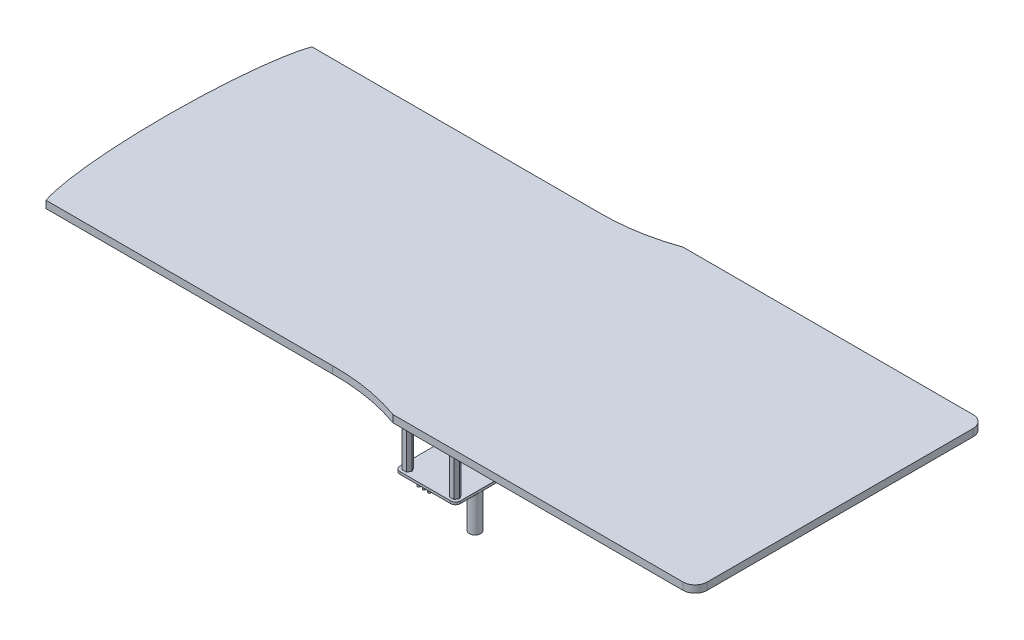
from build123d import *

# Parameters (mm, degrees)
SKETCH_1_W          = 280
SKETCH_1_H          = 120
EXTRUDE_1_DEPTH     = 3
CUT_EXTRUDE_1_DEPTH = 3
CUT_EXTRUDE_2_DEPTH = 3
CUT_EXTRUDE_3_DEPTH = 3
CUT_EXTRUDE_4_DEPTH = 153.345003333
EXTRUDE_2_DEPTH     = 25
SKETCH_6_W          = 25
SKETCH_6_H          = 61
EXTRUDE_3_DEPTH     = 1
SKETCH_7_W          = 8.681884025
SKETCH_7_H          = 50
EXTRUDE_4_DEPTH     = 1
SKETCH_8_W          = 8.681884025
SKETCH_8_H          = 4
SKETCH_8_H_2        = 1.5
CUT_EXTRUDE_5_DEPTH = 1
SKETCH_9_R          = 0.5
EXTRUDE_5_DEPTH     = 7
CUT_EXTRUDE_6_DEPTH = 7
SKETCH_11_W         = 5
SKETCH_11_H         = 4
EXTRUDE_6_DEPTH     = 8
CUT_EXTRUDE_7_DEPTH = 8
SKETCH_13_R         = 0.5
CUT_EXTRUDE_8_DEPTH = 2
SKETCH_14_W         = 1
SKETCH_14_H         = 2
CUT_EXTRUDE_9_DEPTH = 2
SKETCH_15_R         = 2.321585409
EXTRUDE_7_DEPTH     = 15


with BuildPart() as part:
    # 스케치1 → 보스-돌출1 (new body)
    with BuildSketch(Plane(origin=(0, 0, 0), x_dir=(1, 0, 0), z_dir=(0, 1, 0))):
        Rectangle(SKETCH_1_W, SKETCH_1_H)
    extrude(amount=EXTRUDE_1_DEPTH)

    # 스케치2 → 컷-돌출1 (cut)
    with BuildSketch(Plane(origin=(0, 3, 0), x_dir=(1, 0, 0), z_dir=(0, 1, 0))):
        with BuildLine():
            Line((-130, 60), (-140, 60))
            Line((-140, 60), (-140, 0))
            Line((-140, 0), (-140, -60))
            Line((-140, -60), (-130, -60))
            add(Edge.make_bspline(
                [(-130, 60), (-139, 60), (-139, 0), (-139, -60), (-130, -60)],
                knots=[3.141592654, 3.141592654, 3.141592654, 4.71238898, 4.71238898, 6.283185307, 6.283185307, 6.283185307], degree=2, weights=[1, 0.707106781, 1, 0.707106781, 1]))
        make_face()
    extrude(amount=-CUT_EXTRUDE_1_DEPTH, mode=Mode.SUBTRACT)

    # 스케치3 → 컷-돌출2 (cut)
    with BuildSketch(Plane(origin=(0, 3, 0), x_dir=(1, 0, 0), z_dir=(0, 1, 0))):
        with BuildLine():
            Line((-130, -60), (-15, -60))
            Line((-15, -60), (-15, -55))
            Line((-15, -55), (-133.596873642, -55))
            add(Edge.make_bspline(
                [(-133.596873642, -55), (-131.876629727, -60), (-130, -60)],
                knots=[5.856808677, 5.856808677, 5.856808677, 6.283185307, 6.283185307, 6.283185307], degree=2, weights=[0.884154738, 0.920497125, 1]))
        make_face()
        with BuildLine():
            Line((-15, 55), (-15, 60))
            Line((-15, 60), (-130, 60))
            add(Edge.make_bspline(
                [(-130, 60), (-131.876629727, 60), (-133.596873642, 55)],
                knots=[3.141592654, 3.141592654, 3.141592654, 3.567969284, 3.567969284, 3.567969284], degree=2, weights=[1, 0.920497125, 0.884154738]))
            Line((-133.596873642, 55), (-15, 55))
        make_face()
    extrude(amount=-CUT_EXTRUDE_2_DEPTH, mode=Mode.SUBTRACT)

    # 스케치3<4> → 컷-돌출3 (cut)
    with BuildSketch(Plane(origin=(0, 3, 0), x_dir=(1, 0, 0), z_dir=(0, 1, 0))):
        with BuildLine():
            Line((-15, -60), (15, -60))
            add(Edge.make_bspline(
                [(-15, -55), (0.438094674, -54.850371516), (15, -60)],
                knots=[0, 0, 0, 1, 1, 1], degree=2))
            Line((-15, -55), (-15, -60))
        make_face()
        with BuildLine():
            add(Edge.make_bspline(
                [(-15, 55), (0.438094674, 54.850371516), (15, 60)],
                knots=[0, 0, 0, 1, 1, 1], degree=2))
            Line((15, 60), (-15, 60))
            Line((-15, 60), (-15, 55))
        make_face()
    extrude(amount=-CUT_EXTRUDE_3_DEPTH, mode=Mode.SUBTRACT)

    # 스케치4 → 컷-돌출4 (cut, through all)
    with BuildSketch(Plane(origin=(0, 3, 0), x_dir=(1, 0, 0), z_dir=(0, 1, 0))):
        with BuildLine():
            Line((140, -60), (140, -55))
            ThreePointArc((140, -55), (138.535533906, -58.535533906), (135, -60))
            Line((135, -60), (140, -60))
        make_face()
        with BuildLine():
            Line((140, 55), (140, 60))
            Line((140, 60), (135, 60))
            ThreePointArc((135, 60), (138.535533906, 58.535533906), (140, 55))
        make_face()
    extrude(amount=-CUT_EXTRUDE_4_DEPTH, mode=Mode.SUBTRACT)

    # 스케치5 → 보스-돌출2 (add)
    with BuildSketch(Plane(origin=(-8.105663426, 0, 0), x_dir=(-1, 0, 0), z_dir=(0, -1, 0))):
        Polygon((-16.761257695, 8.873383037), (-15.895232292, 7.373383037), (-16.761257695, 5.873383037), (-18.493308503, 5.873383037), (-19.359333907, 7.373383037), (-18.493308503, 8.873383037), align=None)
        Polygon((-39.026995624, 7.373383037), (-38.16097022, 5.873383037), (-36.428919413, 5.873383037), (-35.562894009, 7.373383037), (-36.428919413, 8.873383037), (-38.16097022, 8.873383037), align=None)
        Polygon((-15.895232292, -48.373383037), (-16.761257695, -46.873383037), (-18.493308503, -46.873383037), (-19.359333907, -48.373383037), (-18.493308503, -49.873383037), (-16.761257695, -49.873383037), align=None)
        Polygon((-38.16097022, -49.873383037), (-39.026995624, -48.373383037), (-38.16097022, -46.873383037), (-36.428919413, -46.873383037), (-35.562894009, -48.373383037), (-36.428919413, -49.873383037), align=None)
    extrude(amount=EXTRUDE_2_DEPTH)

    # 스케치6 → 보스-돌출3 (add)
    with BuildSketch(Plane(origin=(-8.105663426, -25, 0), x_dir=(1, 0, 0), z_dir=(0, -1, 0))):
        with Locations((27.461113958, 20.5)):
            Rectangle(SKETCH_6_W, SKETCH_6_H)
    extrude(amount=EXTRUDE_3_DEPTH)

    # 스케치7 → 보스-돌출4 (add)
    with BuildSketch(Plane(origin=(-8.105663426, -26, 0), x_dir=(1, 0, 0), z_dir=(0, -1, 0))):
        with Locations((19.30205597, 20.5)):
            Rectangle(SKETCH_7_W, SKETCH_7_H)
    extrude(amount=EXTRUDE_4_DEPTH)

    # 스케치8 → 컷-돌출5 (cut)
    with BuildSketch(Plane(origin=(-8.105663426, -27, 0), x_dir=(1, 0, 0), z_dir=(0, -1, 0))):
        with Locations((19.30205597, 20.5)):
            Rectangle(SKETCH_8_W, SKETCH_8_H)
        with Locations((19.30205597, 34)):
            Rectangle(SKETCH_8_W, SKETCH_8_H_2)
        with Locations((19.30205597, 7)):
            Rectangle(SKETCH_8_W, SKETCH_8_H_2)
    extrude(amount=-CUT_EXTRUDE_5_DEPTH, mode=Mode.SUBTRACT)

    # 스케치9 → 보스-돌출5 (add)
    with BuildSketch(Plane(origin=(-8.105663426, -27, 0), x_dir=(1, 0, 0), z_dir=(0, -1, 0))):
        with Locations((17.131584964, 43.35)):
            Circle(SKETCH_9_R)
        with Locations((19.30205597, 43.35)):
            Circle(SKETCH_9_R)
        with Locations((21.525534253, 43.35)):
            Circle(SKETCH_9_R)
        with Locations((17.131584964, 41.2)):
            Circle(SKETCH_9_R)
        with Locations((19.30205597, 41.2)):
            Circle(SKETCH_9_R)
        with Locations((21.525534253, 41.2)):
            Circle(SKETCH_9_R)
        with Locations((17.131584964, 39.05)):
            Circle(SKETCH_9_R)
        with Locations((19.30205597, 39.05)):
            Circle(SKETCH_9_R)
        with Locations((21.525534253, 39.05)):
            Circle(SKETCH_9_R)
        with Locations((17.131584964, 36.661336785)):
            Circle(SKETCH_9_R)
        with Locations((19.30205597, 36.661336785)):
            Circle(SKETCH_9_R)
        with Locations((21.525534253, 36.661336785)):
            Circle(SKETCH_9_R)
        with Locations((21.525534253, 31.338663215)):
            Circle(SKETCH_9_R)
        with Locations((19.30205597, 31.338663215)):
            Circle(SKETCH_9_R)
        with Locations((17.131584964, 31.338663215)):
            Circle(SKETCH_9_R)
        with Locations((21.525534253, 28.95)):
            Circle(SKETCH_9_R)
        with Locations((19.30205597, 28.95)):
            Circle(SKETCH_9_R)
        with Locations((17.131584964, 28.95)):
            Circle(SKETCH_9_R)
        with Locations((21.525534253, 26.8)):
            Circle(SKETCH_9_R)
        with Locations((19.30205597, 26.8)):
            Circle(SKETCH_9_R)
        with Locations((17.131584964, 26.8)):
            Circle(SKETCH_9_R)
        with Locations((21.525534253, 24.65)):
            Circle(SKETCH_9_R)
        with Locations((19.30205597, 24.65)):
            Circle(SKETCH_9_R)
        with Locations((17.131584964, 24.65)):
            Circle(SKETCH_9_R)
        with Locations((17.131584964, 16.35)):
            Circle(SKETCH_9_R)
        with Locations((19.30205597, 16.35)):
            Circle(SKETCH_9_R)
        with Locations((21.525534253, 16.35)):
            Circle(SKETCH_9_R)
        with Locations((17.131584964, 14.2)):
            Circle(SKETCH_9_R)
        with Locations((19.30205597, 14.2)):
            Circle(SKETCH_9_R)
        with Locations((21.525534253, 14.2)):
            Circle(SKETCH_9_R)
        with Locations((17.131584964, 12.05)):
            Circle(SKETCH_9_R)
        with Locations((19.30205597, 12.05)):
            Circle(SKETCH_9_R)
        with Locations((21.525534253, 12.05)):
            Circle(SKETCH_9_R)
        with Locations((17.131584964, 9.661336785)):
            Circle(SKETCH_9_R)
        with Locations((19.30205597, 9.661336785)):
            Circle(SKETCH_9_R)
        with Locations((21.525534253, 9.661336785)):
            Circle(SKETCH_9_R)
        with Locations((21.525534253, 4.338663215)):
            Circle(SKETCH_9_R)
        with Locations((19.30205597, 4.338663215)):
            Circle(SKETCH_9_R)
        with Locations((17.131584964, 4.338663215)):
            Circle(SKETCH_9_R)
        with Locations((21.525534253, 1.95)):
            Circle(SKETCH_9_R)
        with Locations((19.30205597, 1.95)):
            Circle(SKETCH_9_R)
        with Locations((17.131584964, 1.95)):
            Circle(SKETCH_9_R)
        with Locations((21.525534253, -0.2)):
            Circle(SKETCH_9_R)
        with Locations((19.30205597, -0.2)):
            Circle(SKETCH_9_R)
        with Locations((17.131584964, -0.2)):
            Circle(SKETCH_9_R)
        with Locations((21.525534253, -2.35)):
            Circle(SKETCH_9_R)
        with Locations((19.30205597, -2.35)):
            Circle(SKETCH_9_R)
        with Locations((17.131584964, -2.35)):
            Circle(SKETCH_9_R)
    extrude(amount=EXTRUDE_5_DEPTH)

    # 스케치10 → 컷-돌출6 (cut)
    with BuildSketch(Plane(origin=(-8.105663426, -26, 0), x_dir=(1, 0, 0), z_dir=(0, -1, 0))):
        with BuildLine():
            Line((39.961113958, 49), (39.961113958, 51))
            Line((39.961113958, 51), (37.961113958, 51))
            ThreePointArc((37.961113958, 51), (39.37532752, 50.414213562), (39.961113958, 49))
        make_face()
        with BuildLine():
            ThreePointArc((14.961113958, 49), (15.546900395, 50.414213562), (16.961113958, 51))
            Line((16.961113958, 51), (14.961113958, 51))
            Line((14.961113958, 51), (14.961113958, 49))
        make_face()
        with BuildLine():
            Line((39.961113958, -10), (39.961113958, -8))
            ThreePointArc((39.961113958, -8), (39.37532752, -9.414213562), (37.961113958, -10))
            Line((37.961113958, -10), (39.961113958, -10))
        make_face()
        with BuildLine():
            Line((14.961113958, -10), (16.961113958, -10))
            ThreePointArc((16.961113958, -10), (15.546900395, -9.414213562), (14.961113958, -8))
            Line((14.961113958, -8), (14.961113958, -10))
        make_face()
    extrude(amount=-CUT_EXTRUDE_6_DEPTH, mode=Mode.SUBTRACT)

    # 스케치11 → 보스-돌출6 (add)
    with BuildSketch(Plane(origin=(-8.105663426, -26, 0), x_dir=(1, 0, 0), z_dir=(0, -1, 0))):
        with Locations((37.461113958, 20.5)):
            Rectangle(SKETCH_11_W, SKETCH_11_H)
    extrude(amount=EXTRUDE_6_DEPTH)

    # 스케치12 → 컷-돌출7 (cut)
    with BuildSketch(Plane(origin=(-8.105663426, 0, 22.5), x_dir=(1, 0, 0), z_dir=(0, 0, 1))):
        Polygon((39.961113958, -32.358999265), (38.473055857, -34), (39.961113958, -34), align=None)
        Polygon((34.961113958, -34), (36.449172058, -34), (34.961113958, -32.358999265), align=None)
    extrude(amount=-CUT_EXTRUDE_7_DEPTH, mode=Mode.SUBTRACT)

    # 스케치13 → 컷-돌출8 (cut)
    with BuildSketch(Plane(origin=(-8.105663426, -34, 0), x_dir=(1, 0, 0), z_dir=(0, -1, 0))):
        with Locations((37.461113958, 21.5)):
            Circle(SKETCH_13_R)
        with Locations((37.461113958, 19.5)):
            Circle(SKETCH_13_R)
    extrude(amount=-CUT_EXTRUDE_8_DEPTH, mode=Mode.SUBTRACT)

    # 스케치14 → 컷-돌출9 (cut)
    with BuildSketch(Plane(origin=(31.855450532, 0, 0), x_dir=(0, 0, -1), z_dir=(1, 0, 0))):
        with Locations((-19.540824187, -27.175682602)):
            Rectangle(SKETCH_14_W, SKETCH_14_H)
        with Locations((-21.459175813, -27.175682602)):
            Rectangle(SKETCH_14_W, SKETCH_14_H)
    extrude(amount=-CUT_EXTRUDE_9_DEPTH, mode=Mode.SUBTRACT)

    # 스케치15 → 보스-돌출7 (add)
    with BuildSketch(Plane(origin=(-8.105663426, -26, 0), x_dir=(1, 0, 0), z_dir=(0, -1, 0))):
        with Locations((37.639528549, 40.594724724)):
            Circle(SKETCH_15_R)
    extrude(amount=EXTRUDE_7_DEPTH)


solid = part.part
